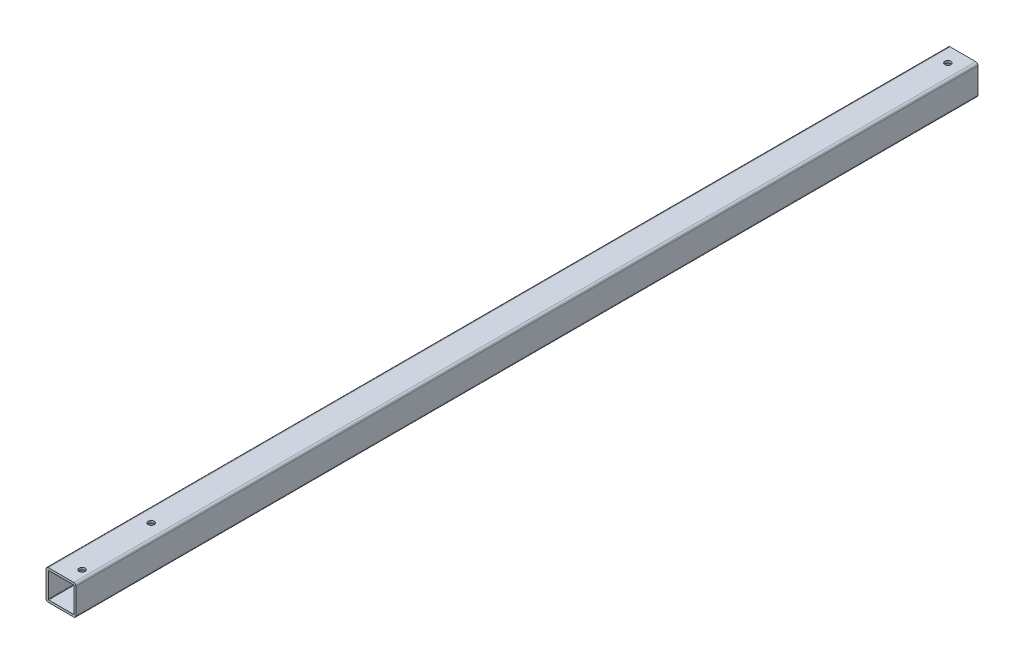
from build123d import *

# Parameters (mm, degrees)
SKETCH1_W                = 40
SKETCH1_H                = 40
SKETCH1_W_2              = 34
SKETCH1_H_2              = 34
EXTRUDE_THIN1_DEPTH      = 1200
FILLET1_R                = 0.5
FILLET2_R                = 3
F_8_0_8_DIAMETER_HOLE1_D = 8
F_8_0_8_DIAMETER_HOLE2_D = 8


with BuildPart() as part:
    # Sketch1 → Extrude-Thin1 (new body)
    with BuildSketch(Plane.XY):
        Rectangle(SKETCH1_W, SKETCH1_H)
        Rectangle(SKETCH1_W_2, SKETCH1_H_2, mode=Mode.SUBTRACT)
    extrude(amount=EXTRUDE_THIN1_DEPTH)

    # Fillet1
    fillet1_edges = [part.edges().sort_by_distance(p)[0] for p in [
        (17, -17, 600),
        (17, 17, 600),
        (-17, 17, 600),
        (-17, -17, 600),
    ]]
    fillet(fillet1_edges, radius=FILLET1_R)

    # Fillet2
    fillet2_edges = [part.edges().sort_by_distance(p)[0] for p in [
        (20, -20, 600),
        (-20, -20, 600),
        (-20, 20, 600),
        (20, 20, 600),
    ]]
    fillet(fillet2_edges, radius=FILLET2_R)

    # Ø8.0 (8) Diameter Hole1 (through all)
    with Locations(Plane(origin=(0, 20, 0), x_dir=(1, 0, 0), z_dir=(0, 1, 0))):
        with Locations((0, -20), (0, -1080)):
            Hole(F_8_0_8_DIAMETER_HOLE1_D / 2)

    # Ø8.0 (8) Diameter Hole2 (through all)
    with Locations(Plane(origin=(0, 20, 0), x_dir=(1, 0, 0), z_dir=(0, 1, 0))):
        with Locations((8, -1180)):
            Hole(F_8_0_8_DIAMETER_HOLE2_D / 2)


solid = part.part
